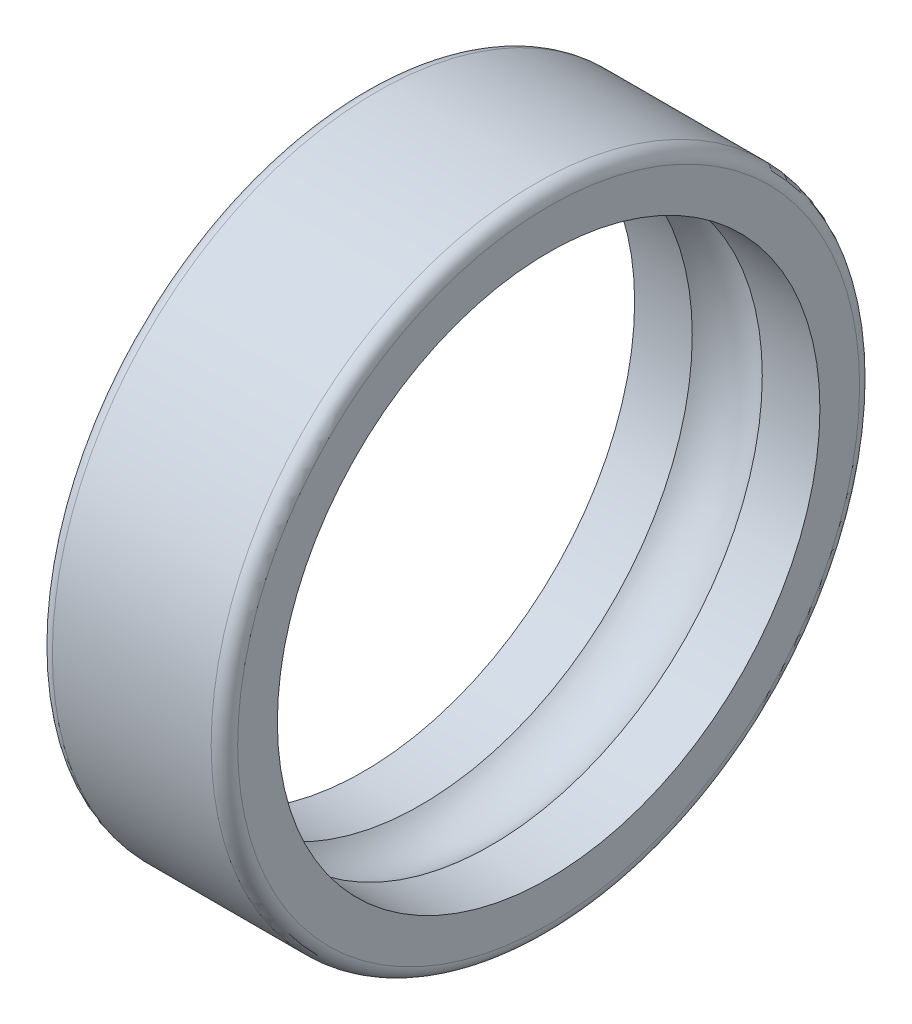
from build123d import *


with BuildPart() as part:
    # Esquisse1 → Base-Révolution (revolve)
    with BuildSketch(Plane.XY):
        with BuildLine():
            Line((-3.428571429, 14), (3.428571429, 14))
            ThreePointArc((3.428571429, 14), (3.832632446, 13.832632446), (4, 13.428571429))
            Line((4, 13.428571429), (4, 11.714285714))
            Line((4, 11.714285714), (1.511857892, 11.714285714))
            ThreePointArc((1.511857892, 11.714285714), (0, 12.285714286), (-1.511857892, 11.714285714))
            Line((-1.511857892, 11.714285714), (-4, 11.714285714))
            Line((-4, 11.714285714), (-4, 13.428571429))
            ThreePointArc((-4, 13.428571429), (-3.832632446, 13.832632446), (-3.428571429, 14))
        make_face()
    revolve(axis=Axis((0, 0, 0), (1, 0, 0)))


solid = part.part
